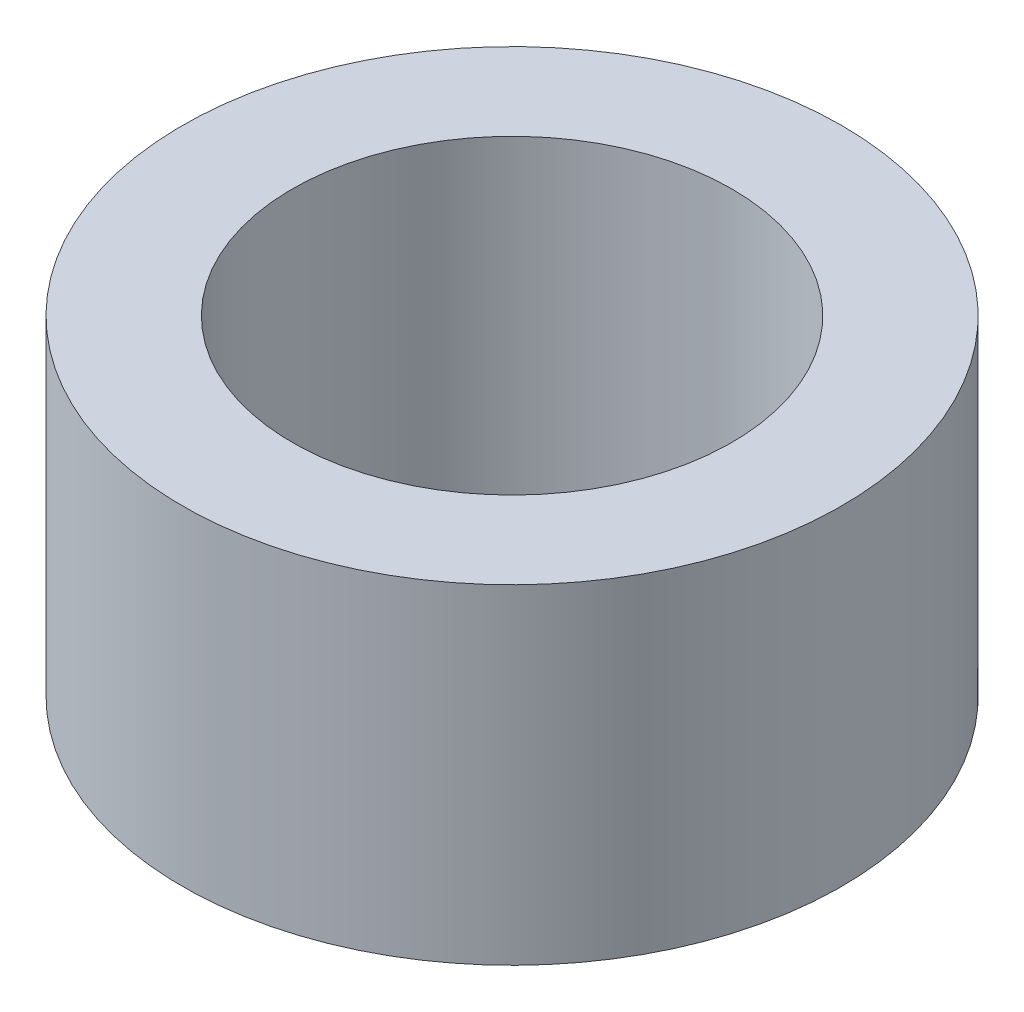
from build123d import *

# Parameters (mm, degrees)
SKETCH1_R           = 9.525
SKETCH1_R_2         = 6.35
BOSS_EXTRUDE1_DEPTH = 4.7625


with BuildPart() as part:
    # Sketch1 → Boss-Extrude1 (new, symmetric)
    with BuildSketch(Plane(origin=(0, 0, 0), x_dir=(1, 0, 0), z_dir=(0, 1, 0))):
        with Locations(Location((0, 0, 0), (0, 0, 90))):
            Circle(SKETCH1_R)
        with Locations(Location((0, 0, 0), (0, 0, 90))):
            Circle(SKETCH1_R_2, mode=Mode.SUBTRACT)
    extrude(amount=BOSS_EXTRUDE1_DEPTH, both=True)


solid = part.part
